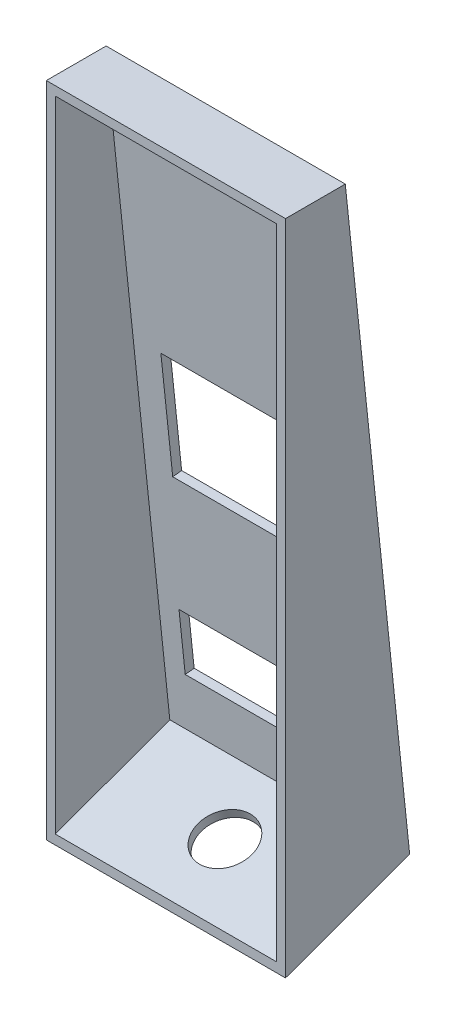
from build123d import *

# Parameters (mm, degrees)
SKETCH6_W          = 300
SKETCH6_H          = 100
SKETCH6_W_2        = 277
SKETCH6_H_2        = 190
CUT_EXTRUDE1_DEPTH = 50
SHELL1_T           = -15
SKETCH7_R          = 45
CUT_EXTRUDE2_DEPTH = 50


with BuildPart() as part:
    # Sketch4 → Loft1 section 0
    with BuildSketch(Plane(origin=(0, -21.618180384, 205.683247011), x_dir=(1, 0, 0), z_dir=(0, 0.10452846326765355, -0.9945218953682733))):
        with BuildLine():
            Line((0, 2924.401999756), (-400, 2924.401999756))
            Line((-400, 2924.401999756), (-400, 3954.401999756))
            Line((-400, 3954.401999756), (0, 3954.401999756))
            Line((0, 3954.401999756), (0, 2924.401999756))
        make_face()
    # Sketch2 → Loft1 section 1
    with BuildSketch(Plane.XY):
        with BuildLine():
            Line((0, -2930), (-400, -2930))
            Line((-400, -2930), (-400, -4030))
            Line((-400, -4030), (0, -4030))
            Line((0, -4030), (0, -2930))
        make_face()
    loft()

    # Sketch6 → Cut-Extrude1 (cut)
    with BuildSketch(Plane(origin=(0, -21.618180384, 205.683247011), x_dir=(-1, 0, 0), z_dir=(0, 0.1045284632676537, -0.9945218953682733))):
        with Locations((200, -3804.401999756)):
            Rectangle(SKETCH6_W, SKETCH6_H)
        with Locations((200, -3449.401999756)):
            Rectangle(SKETCH6_W_2, SKETCH6_H_2)
    extrude(amount=-CUT_EXTRUDE1_DEPTH, mode=Mode.SUBTRACT)

    # Shell1
    shell1_openings = [part.faces().sort_by_distance(p)[0] for p in [
        (-200, -3480, 0),
        (-200, -3857.518574274, -172.348423455),
        (-350, -3807.792479506, -167.122000291),
        (-200, -3758.066384737, -161.895577128),
        (-50, -3807.792479506, -167.122000291),
        (-61.5, -3454.73720665, -130.014395831),
        (-200, -3549.21678671, -139.944599842),
        (-338.5, -3454.73720665, -130.014395831),
        (-200, -3360.25762659, -120.084191821),
        (-200, -3810.405691087, -142.258952907),
        (-200, -3457.350418232, -105.151348447),
    ]]
    offset(amount=SHELL1_T, openings=shell1_openings, kind=Kind.INTERSECTION)

    # Sketch7 → Cut-Extrude2 (cut)
    with BuildSketch(Plane(origin=(0, -3557.931546215, -1295.988905699), x_dir=(1, 0, 0), z_dir=(0, -0.9396070592858665, -0.34225513018823583))):
        with Locations(Location((-200, 1268.782237568, 0), (0, 0, 270))):
            Circle(SKETCH7_R)
    extrude(amount=-CUT_EXTRUDE2_DEPTH, mode=Mode.SUBTRACT)


solid = part.part
